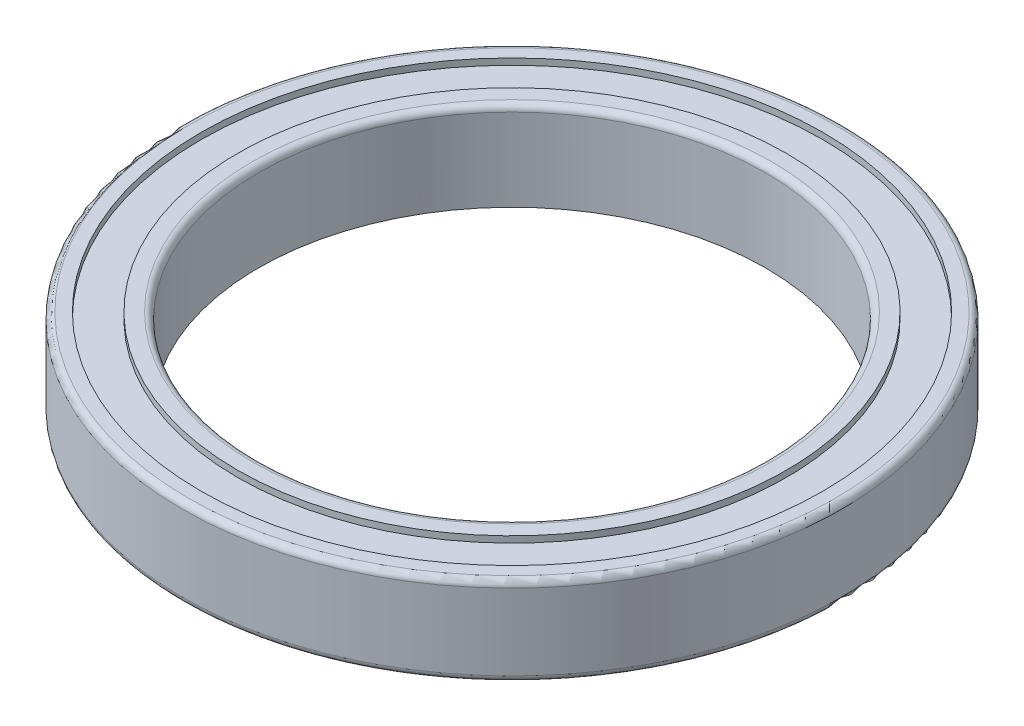
from build123d import *

# Parameters (mm, degrees)
VERRUNDUNG1_R = 0.5


with BuildPart() as part:
    # Skizze1 → Rotation1 (revolve)
    with BuildSketch(Plane.XY, mode=Mode.PRIVATE) as rotation1_sk:
        Polygon((20, 0), (21.65, 0), (21.65, 0.5), (24.525, 0.5), (24.525, 0), (26, 0), (26, 7), (24.525, 7), (24.525, 6.5), (21.65, 6.5), (21.65, 7), (20, 7), align=None)
    revolve(rotation1_sk.sketch.rotate(Axis((0, 0, 0), (0, 1, 0)), 90), axis=Axis((0, 0, 0), (0, 1, 0)))

    # Verrundung1
    verrundung1_edges = [part.edges().sort_by_distance(p)[0] for p in [
        (0, 7, 26),
        (0, 0, 26),
        (0, 7, 20),
    ]]
    fillet(verrundung1_edges, radius=VERRUNDUNG1_R)


solid = part.part
